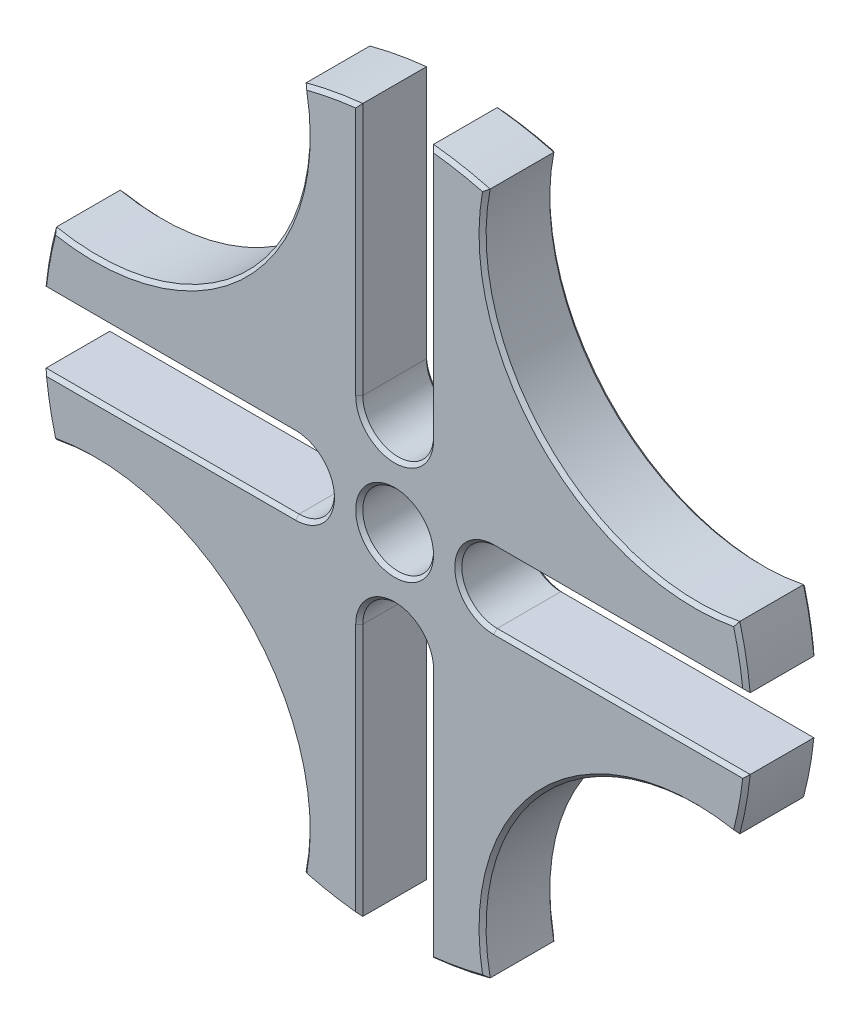
from build123d import *

# Parameters (mm, degrees)
SKETCH1_R                = 50
SKETCH1_R_2              = 5
BOSS_EXTRUDE1_DEPTH      = 10
SKETCH2_R                = 30
CUT_EXTRUDE1_DEPTH       = 72.414284285
CHAMFER1_SIZE            = 0.5
BOSS_EXTRUDE3_DEPTH      = 10
BOSS_EXTRUDE3_DEPTH_BACK = 5
SKETCH4_R                = 8.5
SKETCH4_R_2              = 5
CHAMFER2_SIZE            = 0.5


with BuildPart() as part:
    # Sketch1 → Boss-Extrude1 (new body)
    with BuildSketch(Plane.XY):
        Circle(SKETCH1_R)
        Circle(SKETCH1_R_2, mode=Mode.SUBTRACT)
    extrude(amount=BOSS_EXTRUDE1_DEPTH)

    # Sketch2 → Cut-Extrude1 (cut, through all)
    with BuildSketch(Plane.XY.offset(10)):
        with Locations((42.426406871, 42.426406871)):
            Circle(SKETCH2_R)
        with Locations((42.426406871, -42.426406871)):
            Circle(SKETCH2_R)
        with Locations((-42.426406871, -42.426406871)):
            Circle(SKETCH2_R)
        with Locations((-42.426406871, 42.426406871)):
            Circle(SKETCH2_R)
        with BuildLine():
            Line((-5, 14), (-5, 86))
            ThreePointArc((-5, 86), (0, 91), (5, 86))
            Line((5, 86), (5, 14))
            ThreePointArc((5, 14), (0, 9), (-5, 14))
        make_face()
        with BuildLine():
            Line((14, 5), (86, 5))
            ThreePointArc((86, 5), (91, 0), (86, -5))
            Line((86, -5), (14, -5))
            ThreePointArc((14, -5), (9, 0), (14, 5))
        make_face()
        with BuildLine():
            Line((5, -14), (5, -86))
            ThreePointArc((5, -86), (0, -91), (-5, -86))
            Line((-5, -86), (-5, -14))
            ThreePointArc((-5, -14), (0, -9), (5, -14))
        make_face()
        with BuildLine():
            Line((-14, -5), (-86, -5))
            ThreePointArc((-86, -5), (-91, 0), (-86, 5))
            Line((-86, 5), (-14, 5))
            ThreePointArc((-14, 5), (-9, 0), (-14, -5))
        make_face()
    extrude(amount=-CUT_EXTRUDE1_DEPTH, mode=Mode.SUBTRACT)

    # Chamfer1
    chamfer1_edges = [part.edges().sort_by_distance(p)[0] for p in [
        (-9.031422873, 49.1775701, 0),
        (-5, 31.874685928, 0),
        (5, 31.874685928, 0),
        (5, 31.874685928, 10),
        (-5, 31.874685928, 10),
        (0, 9, 10),
        (0, 9, 0),
        (-49.1775701, 9.031422873, 10),
        (-49.1775701, -9.031422873, 10),
        (-9.031422873, -49.1775701, 10),
        (9.031422873, -49.1775701, 10),
        (49.1775701, -9.031422873, 10),
        (49.1775701, 9.031422873, 10),
        (9.031422873, 49.1775701, 10),
        (-49.1775701, 9.031422873, 0),
        (-49.1775701, -9.031422873, 0),
        (-9.031422873, -49.1775701, 0),
        (9.031422873, -49.1775701, 0),
        (49.1775701, -9.031422873, 0),
        (49.1775701, 9.031422873, 0),
        (9.031422873, 49.1775701, 0),
        (-5, 0, 0),
        (-5, 0, 10),
        (-31.874685928, -5, 0),
        (-31.874685928, 5, 0),
        (-31.874685928, 5, 10),
        (-31.874685928, -5, 10),
        (-9, 0, 10),
        (-9, 0, 0),
        (21.213203436, -21.213203436, 0),
        (21.213203436, -21.213203436, 10),
        (-21.213203436, -21.213203436, 0),
        (-21.213203436, -21.213203436, 10),
        (-21.213203436, 21.213203436, 0),
        (-21.213203436, 21.213203436, 10),
        (5, -31.874685928, 0),
        (-5, -31.874685928, 0),
        (-5, -31.874685928, 10),
        (5, -31.874685928, 10),
        (0, -9, 10),
        (0, -9, 0),
        (31.874685928, 5, 0),
        (31.874685928, -5, 0),
        (31.874685928, -5, 10),
        (31.874685928, 5, 10),
        (9, 0, 10),
        (9, 0, 0),
        (21.213203436, 21.213203436, 0),
        (21.213203436, 21.213203436, 10),
        (-9.031422873, 49.1775701, 10),
    ]]
    chamfer(chamfer1_edges, length=CHAMFER1_SIZE)

    # Sketch4 → Boss-Extrude3 (add, two sides: drawn at the far end of the back side and taken through both)
    with BuildSketch(Plane(origin=(0, 0, 0), x_dir=(-1, 0, 0), z_dir=(0, 0, -1)).offset(-BOSS_EXTRUDE3_DEPTH_BACK)):
        Circle(SKETCH4_R)
        Circle(SKETCH4_R_2, mode=Mode.SUBTRACT)
    extrude(amount=BOSS_EXTRUDE3_DEPTH + BOSS_EXTRUDE3_DEPTH_BACK)

    # Chamfer2
    chamfer2_edges = [part.edges().sort_by_distance(p)[0] for p in [
        (5, 0, -10),
        (8.5, 0, -10),
    ]]
    chamfer(chamfer2_edges, length=CHAMFER2_SIZE)


solid = part.part
